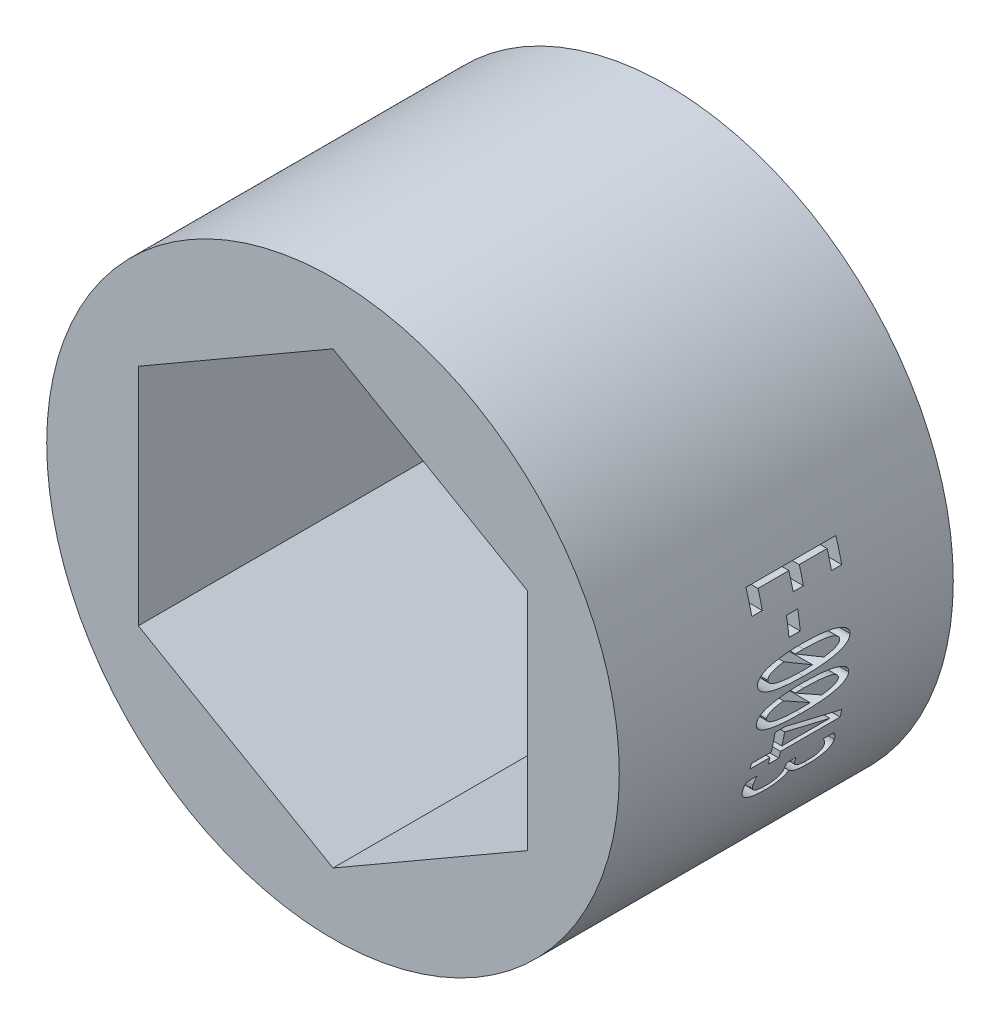
from build123d import *

# Parameters (mm, degrees)
SKETCH1_R           = 9.525
BOSS_EXTRUDE1_DEPTH = 5.55625
CUT_EXTRUDE4_START  = 14.2875
SKETCH2_W           = 0.375088852
SKETCH2_H           = 0.595529859
CUT_EXTRUDE4_DEPTH  = 2.54


with BuildPart() as part:
    # Sketch1 → Boss-Extrude1 (new, symmetric)
    with BuildSketch(Plane.XY):
        Circle(SKETCH1_R)
        Polygon((0, 7.478995387), (-6.477, 3.739497694), (-6.477, -3.739497694), (0, -7.478995387), (6.477, -3.739497694), (6.477, 3.739497694), align=None, mode=Mode.SUBTRACT)
    extrude(amount=BOSS_EXTRUDE1_DEPTH, both=True)

    # Sketch2 → Cut-Extrude4 (cut)
    # profile 1 of 6: a face of its own
    with BuildSketch(Plane(origin=(-6.477, 0, 0), x_dir=(0, 0, -1), z_dir=(1, 0, 0)).offset(CUT_EXTRUDE4_START)):
        with BuildLine():
            add(Edge.make_bspline(
                [(-0.004504865, -3.590276089), (-0.036849602, -3.589961675), (-0.100483102, -3.589343114), (-0.194404197, -3.582176638), (-0.28538672, -3.571387887), (-0.373143847, -3.55689064), (-0.456768953, -3.537223473), (-0.535233271, -3.51305414), (-0.608325095, -3.484209866), (-0.676243071, -3.452343836), (-0.737432478, -3.414779692), (-0.792407137, -3.373410062), (-0.839991372, -3.326938439), (-0.88129647, -3.276700722), (-0.91447967, -3.22139649), (-0.937271726, -3.160926816), (-0.952262025, -3.096535433), (-0.953926373, -3.052033881), (-0.954775175, -3.029338511)],
                knots=[0, 0, 0, 0, 1.267245369, 2.493118337, 3.688779014, 4.856943456, 5.976591649, 7.052696471, 8.071123327, 9.053894224, 9.988393857, 10.879728606, 11.744375567, 12.588441494, 13.422638248, 14.25848013, 15.111841352, 16, 16, 16, 16], degree=3))
            add(Edge.make_bspline(
                [(-0.954775175, -3.029338511), (-0.954397763, -3.004660619), (-0.953681714, -2.957840221), (-0.944481284, -2.891124962), (-0.930635315, -2.830785328), (-0.919039471, -2.792785557), (-0.913400094, -2.774305223)],
                knots=[0, 0, 0, 0, 1.140264574, 2.163379257, 3.106800788, 4, 4, 4, 4], degree=3))
            Line((-0.913400094, -2.774305223), (-0.555946522, -2.774305223))
            add(Edge.make_bspline(
                [(-0.555946522, -2.774305223), (-0.563803945, -2.795430455), (-0.579714666, -2.838207541), (-0.596389662, -2.905216944), (-0.606925447, -2.974516215), (-0.608207948, -3.021387568), (-0.608852364, -3.044938952)],
                knots=[0, 0, 0, 0, 0.97444165, 1.973174744, 2.981583908, 4, 4, 4, 4], degree=3))
            add(Edge.make_bspline(
                [(-0.608852364, -3.044938952), (-0.608320966, -3.060573088), (-0.607290287, -3.090896422), (-0.599639186, -3.134617682), (-0.587676103, -3.175199685), (-0.569766702, -3.212127253), (-0.547148516, -3.245480295), (-0.520497053, -3.275887041), (-0.488762925, -3.302191382), (-0.440207216, -3.335128835), (-0.366990391, -3.366662465), (-0.266448812, -3.391789501), (-0.151656922, -3.406229786), (-0.070339902, -3.407715528), (-0.027566385, -3.408497043)],
                knots=[0, 0, 0, 0, 0.725617714, 1.407378561, 2.054979674, 2.684193736, 3.304409742, 3.921686529, 4.55482967, 5.212898424, 6.641321727, 8.225180246, 10.014409319, 12, 12, 12, 12], degree=3))
            add(Edge.make_bspline(
                [(-0.027566385, -3.408497043), (-0.007657639, -3.408324976), (0.030865106, -3.407992033), (0.08677526, -3.402923776), (0.13869825, -3.395787536), (0.200706153, -3.382549301), (0.269687827, -3.359966956), (0.340165368, -3.321099207), (0.396555621, -3.273195918), (0.435698507, -3.215321396), (0.461126275, -3.150945863), (0.463609517, -3.105313584), (0.46486491, -3.082244353)],
                knots=[0, 0, 0, 0, 0.902415816, 1.746143755, 2.543568264, 3.27750534, 4.619705547, 5.817620366, 6.907431183, 7.939688657, 8.958417152, 10, 10, 10, 10], degree=3))
            Line((0.46486491, -3.082244353), (0.46486491, -2.933701028))
            Line((0.46486491, -2.933701028), (0.791795881, -2.933701028))
            Line((0.791795881, -2.933701028), (0.791795881, -3.084279193))
            add(Edge.make_bspline(
                [(0.791795881, -3.084279193), (0.793515656, -3.103130151), (0.797004888, -3.141376631), (0.825676418, -3.194554761), (0.870980927, -3.239776492), (0.931275339, -3.277829637), (1.006885583, -3.307095385), (1.096882274, -3.329082108), (1.201102029, -3.342166252), (1.275144979, -3.343852311), (1.314071497, -3.344738721)],
                knots=[0, 0, 0, 0, 0.702931155, 1.426168471, 2.204542608, 3.080538336, 4.075750171, 5.227735779, 6.542540608, 8, 8, 8, 8], degree=3))
            add(Edge.make_bspline(
                [(1.314071497, -3.344738721), (1.351419461, -3.344105004), (1.420920718, -3.342925712), (1.517072784, -3.330828034), (1.597521848, -3.312202775), (1.662762807, -3.284689056), (1.712542728, -3.24790835), (1.749265671, -3.20392149), (1.770357456, -3.150879061), (1.77272656, -3.11317306), (1.773945352, -3.093775113)],
                knots=[0, 0, 0, 0, 1.526226429, 2.840172395, 3.954417886, 4.893921033, 5.712919157, 6.462176078, 7.208862642, 8, 8, 8, 8], degree=3))
            add(Edge.make_bspline(
                [(1.773945352, -3.093775113), (1.772435914, -3.071431608), (1.769300114, -3.025013813), (1.744267513, -2.9552649), (1.707383655, -2.881601937), (1.673404849, -2.834219171), (1.655246348, -2.808897504)],
                knots=[0, 0, 0, 0, 0.853273687, 1.772644092, 2.809686135, 4, 4, 4, 4], degree=3))
            Line((1.655246348, -2.808897504), (2.003203999, -2.808897504))
            add(Edge.make_bspline(
                [(2.003203999, -2.808897504), (2.012010967, -2.820508087), (2.029659868, -2.843775348), (2.052123202, -2.881125), (2.073035597, -2.918730765), (2.088597512, -2.957566848), (2.102927916, -2.995476736), (2.111987256, -3.033567144), (2.118614991, -3.070486342), (2.119459961, -3.094878615), (2.119868163, -3.106662433)],
                knots=[0, 0, 0, 0, 1.074653237, 2.153572784, 3.213618405, 4.245582762, 5.237796202, 6.200962935, 7.130891746, 8, 8, 8, 8], degree=3))
            add(Edge.make_bspline(
                [(2.119868163, -3.106662433), (2.119176996, -3.123434748), (2.117820593, -3.156350162), (2.108326594, -3.204228284), (2.091849274, -3.248754418), (2.069023841, -3.289977466), (2.04065304, -3.328051535), (2.005639077, -3.362309802), (1.966043136, -3.394350284), (1.91988341, -3.421640645), (1.869739644, -3.447399393), (1.813326272, -3.467622567), (1.752544025, -3.487261517), (1.68611797, -3.501487931), (1.615283147, -3.513232061), (1.540058614, -3.520853449), (1.460450242, -3.526877861), (1.405878306, -3.527088027), (1.377829819, -3.527196047)],
                knots=[0, 0, 0, 0, 0.846782721, 1.661798233, 2.452872064, 3.234664171, 4.033852633, 4.841154891, 5.70236139, 6.599157565, 7.543735706, 8.544595172, 9.620702131, 10.767412401, 11.970536557, 13.245205212, 14.584110592, 16, 16, 16, 16], degree=3))
            add(Edge.make_bspline(
                [(1.377829819, -3.527196047), (1.336877953, -3.526665357), (1.257983224, -3.525642972), (1.144898972, -3.514559965), (1.041722119, -3.497583807), (0.949165982, -3.472378463), (0.865909193, -3.44115093), (0.79244148, -3.40369841), (0.72619465, -3.362851397), (0.689155206, -3.329265653), (0.671062037, -3.31285956)],
                knots=[0, 0, 0, 0, 1.298857871, 2.502280128, 3.601383938, 4.61240848, 5.540980403, 6.416766349, 7.226615945, 8, 8, 8, 8], degree=3))
            add(Edge.make_bspline(
                [(0.671062037, -3.31285956), (0.662830297, -3.330128808), (0.644763918, -3.368030003), (0.596401203, -3.416915174), (0.533469142, -3.463879209), (0.454228533, -3.505478772), (0.359557944, -3.540322982), (0.250678187, -3.568632782), (0.127474538, -3.587267182), (0.040785248, -3.589243551), (-0.004504865, -3.590276089)],
                knots=[0, 0, 0, 0, 0.596476053, 1.309098976, 2.124548232, 3.057205658, 4.102909643, 5.282744885, 6.580392206, 8, 8, 8, 8], degree=3))
        make_face()
    # profile 2 of 6: a face of its own
    with BuildSketch(Plane(origin=(-6.477, 0, 0), x_dir=(0, 0, -1), z_dir=(1, 0, 0)).offset(CUT_EXTRUDE4_START)):
        Polygon((-0.252077073, -2.551151096), (-0.252077073, -2.328675249), (-0.913400094, -2.328675249), (-0.913400094, -2.151644163), (-0.252077073, -2.151644163), (-0.252077073, -1.524913423), (0.098593699, -1.524913423), (2.078493081, -2.079746481), (2.078493081, -2.328675249), (0.098593699, -2.328675249), (0.098593699, -2.551151096), align=None)
        Polygon((1.693908309, -2.151644163), (0.098593699, -1.698553109), (0.098593699, -2.151644163), align=None, mode=Mode.SUBTRACT)
    # profile 3 of 6: a face of its own
    with BuildSketch(Plane(origin=(-6.477, 0, 0), x_dir=(0, 0, -1), z_dir=(1, 0, 0)).offset(CUT_EXTRUDE4_START)):
        with BuildLine():
            add(Edge.make_bspline(
                [(0.581529074, -1.387900859), (0.525680655, -1.387455469), (0.416218321, -1.386582508), (0.255844111, -1.381369358), (0.102974567, -1.371691623), (-0.041841976, -1.35918652), (-0.177870416, -1.342517227), (-0.304298093, -1.321341583), (-0.421021612, -1.297402145), (-0.527548688, -1.269140745), (-0.62312566, -1.237073057), (-0.707352279, -1.200732472), (-0.78110782, -1.162307133), (-0.842526443, -1.118620115), (-0.893188599, -1.07223601), (-0.928034523, -1.019697259), (-0.951317972, -0.963571305), (-0.953614928, -0.924183111), (-0.954775175, -0.904287204)],
                knots=[0, 0, 0, 0, 1.559510505, 3.056624766, 4.479873884, 5.836243671, 7.115003274, 8.305482651, 9.414907697, 10.440956897, 11.381305831, 12.226869531, 13.0008142, 13.698031297, 14.327626941, 14.905461587, 15.447122789, 16, 16, 16, 16], degree=3))
            add(Edge.make_bspline(
                [(-0.954775175, -0.904287204), (-0.953774788, -0.887191764), (-0.951763519, -0.852821527), (-0.933723368, -0.802899562), (-0.904178011, -0.756218429), (-0.864119786, -0.711401937), (-0.811484156, -0.67020471), (-0.747549072, -0.631613332), (-0.671171323, -0.59748536), (-0.583309871, -0.56544668), (-0.482444938, -0.537676615), (-0.369252591, -0.511410355), (-0.242638065, -0.491495229), (-0.103639229, -0.472700182), (0.048919958, -0.459057794), (0.214438903, -0.447977704), (0.393603568, -0.442142042), (0.517314993, -0.441404684), (0.581529074, -0.441021949)],
                knots=[0, 0, 0, 0, 0.478201036, 0.961419182, 1.468147296, 2.020459732, 2.638313593, 3.335286464, 4.109759075, 4.980217882, 5.955596714, 7.041449094, 8.236964293, 9.54789858, 10.974296665, 12.530917253, 14.199325911, 16, 16, 16, 16], degree=3))
            add(Edge.make_bspline(
                [(0.581529074, -0.441021949), (0.637604465, -0.441453167), (0.747068666, -0.442294943), (0.907656852, -0.447675754), (1.0605829, -0.456930277), (1.20575784, -0.470689207), (1.3422871, -0.48703383), (1.469171566, -0.508216508), (1.586129232, -0.532147541), (1.692520762, -0.560622546), (1.78844644, -0.591955349), (1.873058674, -0.627691545), (1.946116581, -0.667620779), (2.007695374, -0.710893581), (2.05799744, -0.757336391), (2.093508218, -0.809469808), (2.11618561, -0.865660077), (2.118641354, -0.904988443), (2.119868163, -0.924635604)],
                knots=[0, 0, 0, 0, 1.564355102, 3.053761693, 4.481971523, 5.837641803, 7.121461735, 8.317046844, 9.425431576, 10.450518643, 11.387972169, 12.238539193, 13.009232864, 13.705796177, 14.334801444, 14.906867582, 15.453906914, 16, 16, 16, 16], degree=3))
            add(Edge.make_bspline(
                [(2.119868163, -0.924635604), (2.118870107, -0.941733191), (2.116863524, -0.976107746), (2.098787367, -1.025996536), (2.069309116, -1.072942741), (2.028481294, -1.117262315), (1.976243262, -1.158654035), (1.911844158, -1.196887562), (1.83523587, -1.231455881), (1.746527158, -1.263291656), (1.645321998, -1.291432833), (1.531757898, -1.317191224), (1.405107322, -1.338404239), (1.266000326, -1.356762151), (1.113717095, -1.370760148), (0.948362175, -1.380696102), (0.769459423, -1.386853063), (0.645744809, -1.387542828), (0.581529074, -1.387900859)],
                knots=[0, 0, 0, 0, 0.477718004, 0.960448049, 1.466664315, 2.022655806, 2.639885571, 3.327457971, 4.115303192, 4.990836399, 5.965229999, 7.056162241, 8.251527417, 9.561137526, 10.986094801, 12.534421384, 14.201144778, 16, 16, 16, 16], degree=3))
        make_face()
        with BuildLine():
            add(Edge.make_bspline(
                [(0.567963473, -1.212226333), (0.593738265, -1.212034314), (0.64506477, -1.211651939), (0.721952313, -1.210471859), (0.797691222, -1.20764417), (0.847869025, -1.205258546), (0.872511203, -1.204086973)],
                knots=[0, 0, 0, 0, 1.015160182, 2.021534328, 3.028381099, 4, 4, 4, 4], degree=3))
            Line((0.872511203, -1.204086973), (-0.068941467, -0.653323596))
            add(Edge.make_bspline(
                [(-0.068941467, -0.653323596), (-0.106988786, -0.658593594), (-0.180664248, -0.668798506), (-0.285317443, -0.68960569), (-0.379072358, -0.713489712), (-0.458289186, -0.743960233), (-0.523742191, -0.77709382), (-0.566689032, -0.810948265), (-0.591459897, -0.840716753), (-0.604212522, -0.863928755), (-0.61191959, -0.888655828), (-0.613037295, -0.905816795), (-0.613600324, -0.914461404)],
                knots=[0, 0, 0, 0, 1.78798212, 3.462278352, 4.966290027, 6.285886554, 7.406685485, 8.371772892, 8.805805392, 9.201507961, 9.597770224, 10, 10, 10, 10], degree=3))
            add(Edge.make_bspline(
                [(-0.613600324, -0.914461404), (-0.6127127, -0.925716283), (-0.610918276, -0.948469184), (-0.594787865, -0.980666572), (-0.571505257, -1.011882689), (-0.537147677, -1.040106246), (-0.49405508, -1.066297482), (-0.442090837, -1.090517589), (-0.38126196, -1.112823568), (-0.311165139, -1.132884252), (-0.232168759, -1.151109285), (-0.143978022, -1.166216489), (-0.047272097, -1.180814814), (0.058683641, -1.191767609), (0.173511655, -1.201770294), (0.297294336, -1.20709751), (0.429787705, -1.211595876), (0.520931324, -1.212011739), (0.567963473, -1.212226333)],
                knots=[0, 0, 0, 0, 0.419057116, 0.847167283, 1.324665784, 1.871049416, 2.498350951, 3.210320311, 4.01394371, 4.922201168, 5.938783807, 7.048151018, 8.27180717, 9.600358375, 11.036052643, 12.587245687, 14.238942289, 16, 16, 16, 16], degree=3))
        make_face(mode=Mode.SUBTRACT)
        with BuildLine():
            add(Edge.make_bspline(
                [(0.595094674, -0.616696474), (0.571580363, -0.616624063), (0.524324565, -0.616478541), (0.453790378, -0.61757104), (0.384118419, -0.617468256), (0.338248131, -0.619677461), (0.315643305, -0.620766155)],
                knots=[0, 0, 0, 0, 1.009489237, 2.028731323, 3.028561052, 4, 4, 4, 4], degree=3))
            Line((0.315643305, -0.620766155), (1.252348015, -1.171529532))
            add(Edge.make_bspline(
                [(1.252348015, -1.171529532), (1.289497916, -1.16629634), (1.360728915, -1.156262249), (1.461544734, -1.135288573), (1.551243573, -1.111004061), (1.627981963, -1.081449716), (1.691341975, -1.048592662), (1.732835735, -1.015047852), (1.756539805, -0.98568192), (1.770001642, -0.963637684), (1.776878463, -0.939264511), (1.778078586, -0.922862711), (1.778693312, -0.914461404)],
                knots=[0, 0, 0, 0, 1.802349063, 3.455813386, 4.94519112, 6.262656811, 7.400261342, 8.364261102, 8.796932704, 9.210637733, 9.595673984, 10, 10, 10, 10], degree=3))
            add(Edge.make_bspline(
                [(1.778693312, -0.914461404), (1.777787248, -0.903220746), (1.775955547, -0.880496594), (1.760138326, -0.848108327), (1.735577453, -0.81792937), (1.701779277, -0.789585437), (1.658853577, -0.763245959), (1.607199141, -0.738097002), (1.545623211, -0.716203248), (1.475120732, -0.696061318), (1.395608572, -0.677983469), (1.307182004, -0.661570168), (1.20978679, -0.648502212), (1.103713164, -0.637040682), (0.989087788, -0.627214395), (0.865540308, -0.621793316), (0.733269834, -0.617333668), (0.642126617, -0.616913362), (0.595094674, -0.616696474)],
                knots=[0, 0, 0, 0, 0.418543778, 0.846129516, 1.321541468, 1.867255789, 2.486615157, 3.201373057, 4.011945759, 4.927212179, 5.94254952, 7.060387512, 8.289719685, 9.616643435, 11.050579, 12.591426258, 14.241099557, 16, 16, 16, 16], degree=3))
        make_face(mode=Mode.SUBTRACT)
    # profile 4 of 6: a face of its own
    with BuildSketch(Plane(origin=(-6.477, 0, 0), x_dir=(0, 0, -1), z_dir=(1, 0, 0)).offset(CUT_EXTRUDE4_START)):
        with BuildLine():
            add(Edge.make_bspline(
                [(0.581529074, -0.259242903), (0.525680655, -0.258797513), (0.416218321, -0.257924552), (0.255844111, -0.252711403), (0.102974567, -0.243033667), (-0.041841976, -0.230528564), (-0.177870416, -0.213859272), (-0.304298093, -0.192683627), (-0.421021612, -0.16874419), (-0.527548688, -0.14048279), (-0.62312566, -0.108415102), (-0.707352279, -0.072074516), (-0.78110782, -0.033649177), (-0.842526443, 0.010037841), (-0.893188599, 0.056421946), (-0.928034523, 0.108960696), (-0.951317972, 0.16508665), (-0.953614928, 0.204474845), (-0.954775175, 0.224370752)],
                knots=[0, 0, 0, 0, 1.559510505, 3.056624766, 4.479873884, 5.836243671, 7.115003274, 8.305482651, 9.414907697, 10.440956897, 11.381305831, 12.226869531, 13.0008142, 13.698031297, 14.327626941, 14.905461587, 15.447122789, 16, 16, 16, 16], degree=3))
            add(Edge.make_bspline(
                [(-0.954775175, 0.224370752), (-0.953774788, 0.241466191), (-0.951763519, 0.275836429), (-0.933723368, 0.325758394), (-0.904178011, 0.372439527), (-0.864119786, 0.417256019), (-0.811484156, 0.458453246), (-0.747549072, 0.497044624), (-0.671171323, 0.531172596), (-0.583309871, 0.563211276), (-0.482444938, 0.590981341), (-0.369252591, 0.617247601), (-0.242638065, 0.637162727), (-0.103639229, 0.655957774), (0.048919958, 0.669600162), (0.214438903, 0.680680252), (0.393603568, 0.686515914), (0.517314993, 0.687253271), (0.581529074, 0.687636007)],
                knots=[0, 0, 0, 0, 0.478201036, 0.961419182, 1.468147296, 2.020459732, 2.638313593, 3.335286464, 4.109759075, 4.980217882, 5.955596714, 7.041449094, 8.236964293, 9.54789858, 10.974296665, 12.530917253, 14.199325911, 16, 16, 16, 16], degree=3))
            add(Edge.make_bspline(
                [(0.581529074, 0.687636007), (0.637604465, 0.687204789), (0.747068666, 0.686363012), (0.907656852, 0.680982202), (1.0605829, 0.671727678), (1.20575784, 0.657968749), (1.3422871, 0.641624126), (1.469171566, 0.620441448), (1.586129232, 0.596510414), (1.692520762, 0.56803541), (1.78844644, 0.536702607), (1.873058674, 0.500966411), (1.946116581, 0.461037177), (2.007695374, 0.417764374), (2.05799744, 0.371321565), (2.093508218, 0.319188148), (2.11618561, 0.262997878), (2.118641354, 0.223669513), (2.119868163, 0.204022352)],
                knots=[0, 0, 0, 0, 1.564355102, 3.053761693, 4.481971523, 5.837641803, 7.121461735, 8.317046844, 9.425431576, 10.450518643, 11.387972169, 12.238539193, 13.009232864, 13.705796177, 14.334801444, 14.906867582, 15.453906914, 16, 16, 16, 16], degree=3))
            add(Edge.make_bspline(
                [(2.119868163, 0.204022352), (2.118870107, 0.186924765), (2.116863524, 0.152550209), (2.098787367, 0.10266142), (2.069309116, 0.055715215), (2.028481294, 0.011395641), (1.976243262, -0.029996079), (1.911844158, -0.068229606), (1.83523587, -0.102797926), (1.746527158, -0.1346337), (1.645321998, -0.162774877), (1.531757898, -0.188533268), (1.405107322, -0.209746283), (1.266000326, -0.228104195), (1.113717095, -0.242102192), (0.948362175, -0.252038146), (0.769459423, -0.258195108), (0.645744809, -0.258884872), (0.581529074, -0.259242903)],
                knots=[0, 0, 0, 0, 0.477718004, 0.960448049, 1.466664315, 2.022655806, 2.639885571, 3.327457971, 4.115303192, 4.990836399, 5.965229999, 7.056162241, 8.251527417, 9.561137526, 10.986094801, 12.534421384, 14.201144778, 16, 16, 16, 16], degree=3))
        make_face()
        with BuildLine():
            add(Edge.make_bspline(
                [(0.567963473, -0.083568378), (0.593738265, -0.083376359), (0.64506477, -0.082993983), (0.721952313, -0.081813903), (0.797691222, -0.078986214), (0.847869025, -0.07660059), (0.872511203, -0.075429017)],
                knots=[0, 0, 0, 0, 1.015160182, 2.021534328, 3.028381099, 4, 4, 4, 4], degree=3))
            Line((0.872511203, -0.075429017), (-0.068941467, 0.47533436))
            add(Edge.make_bspline(
                [(-0.068941467, 0.47533436), (-0.106988786, 0.470064362), (-0.180664248, 0.459859449), (-0.285317443, 0.439052266), (-0.379072358, 0.415168244), (-0.458289186, 0.384697723), (-0.523742191, 0.351564136), (-0.566689032, 0.31770969), (-0.591459897, 0.287941203), (-0.604212522, 0.264729201), (-0.61191959, 0.240002128), (-0.613037295, 0.222841161), (-0.613600324, 0.214196552)],
                knots=[0, 0, 0, 0, 1.78798212, 3.462278352, 4.966290027, 6.285886554, 7.406685485, 8.371772892, 8.805805392, 9.201507961, 9.597770224, 10, 10, 10, 10], degree=3))
            add(Edge.make_bspline(
                [(-0.613600324, 0.214196552), (-0.6127127, 0.202941673), (-0.610918276, 0.180188772), (-0.594787865, 0.147991384), (-0.571505257, 0.116775267), (-0.537147677, 0.08855171), (-0.49405508, 0.062360474), (-0.442090837, 0.038140367), (-0.38126196, 0.015834388), (-0.311165139, -0.004226296), (-0.232168759, -0.022451329), (-0.143978022, -0.037558533), (-0.047272097, -0.052156859), (0.058683641, -0.063109653), (0.173511655, -0.073112338), (0.297294336, -0.078439554), (0.429787705, -0.08293792), (0.520931324, -0.083353783), (0.567963473, -0.083568378)],
                knots=[0, 0, 0, 0, 0.419057116, 0.847167283, 1.324665784, 1.871049416, 2.498350951, 3.210320311, 4.01394371, 4.922201168, 5.938783807, 7.048151018, 8.27180717, 9.600358375, 11.036052643, 12.587245687, 14.238942289, 16, 16, 16, 16], degree=3))
        make_face(mode=Mode.SUBTRACT)
        with BuildLine():
            add(Edge.make_bspline(
                [(0.595094674, 0.511961481), (0.571580363, 0.512033893), (0.524324565, 0.512179415), (0.453790378, 0.511086916), (0.384118419, 0.5111897), (0.338248131, 0.508980495), (0.315643305, 0.507891801)],
                knots=[0, 0, 0, 0, 1.009489237, 2.028731323, 3.028561052, 4, 4, 4, 4], degree=3))
            Line((0.315643305, 0.507891801), (1.252348015, -0.042871576))
            add(Edge.make_bspline(
                [(1.252348015, -0.042871576), (1.289497916, -0.037638384), (1.360728915, -0.027604293), (1.461544734, -0.006630617), (1.551243573, 0.017653895), (1.627981963, 0.04720824), (1.691341975, 0.080065293), (1.732835735, 0.113610104), (1.756539805, 0.142976035), (1.770001642, 0.165020272), (1.776878463, 0.189393445), (1.778078586, 0.205795245), (1.778693312, 0.214196552)],
                knots=[0, 0, 0, 0, 1.802349063, 3.455813386, 4.94519112, 6.262656811, 7.400261342, 8.364261102, 8.796932704, 9.210637733, 9.595673984, 10, 10, 10, 10], degree=3))
            add(Edge.make_bspline(
                [(1.778693312, 0.214196552), (1.777787248, 0.22543721), (1.775955547, 0.248161361), (1.760138326, 0.280549629), (1.735577453, 0.310728585), (1.701779277, 0.339072519), (1.658853577, 0.365411996), (1.607199141, 0.390560954), (1.545623211, 0.412454708), (1.475120732, 0.432596638), (1.395608572, 0.450674487), (1.307182004, 0.467087788), (1.20978679, 0.480155744), (1.103713164, 0.491617274), (0.989087788, 0.501443561), (0.865540308, 0.50686464), (0.733269834, 0.511324288), (0.642126617, 0.511744594), (0.595094674, 0.511961481)],
                knots=[0, 0, 0, 0, 0.418543778, 0.846129516, 1.321541468, 1.867255789, 2.486615157, 3.201373057, 4.011945759, 4.927212179, 5.94254952, 7.060387512, 8.289719685, 9.616643435, 11.050579, 12.591426258, 14.241099557, 16, 16, 16, 16], degree=3))
        make_face(mode=Mode.SUBTRACT)
    # profile 5 of 6: a face of its own
    with BuildSketch(Plane(origin=(-6.477, 0, 0), x_dir=(0, 0, -1), z_dir=(1, 0, 0)).offset(CUT_EXTRUDE4_START)):
        with Locations((0.334296006, 1.342854508)):
            Rectangle(SKETCH2_W, SKETCH2_H)
    # profile 6 of 6: a face of its own
    with BuildSketch(Plane(origin=(-6.477, 0, 0), x_dir=(0, 0, -1), z_dir=(1, 0, 0)).offset(CUT_EXTRUDE4_START)):
        Polygon((-0.913400094, 2.091675651), (-0.913400094, 2.832357435), (2.078493081, 2.832357435), (2.078493081, 2.091675651), (1.735283391, 2.091675651), (1.735283391, 2.654648069), (0.808074601, 2.654648069), (0.808074601, 2.114058892), (0.46486491, 2.114058892), (0.46486491, 2.654648069), (-0.565442442, 2.654648069), (-0.565442442, 2.091675651), align=None)
    extrude(amount=CUT_EXTRUDE4_DEPTH, mode=Mode.SUBTRACT)


solid = part.part
